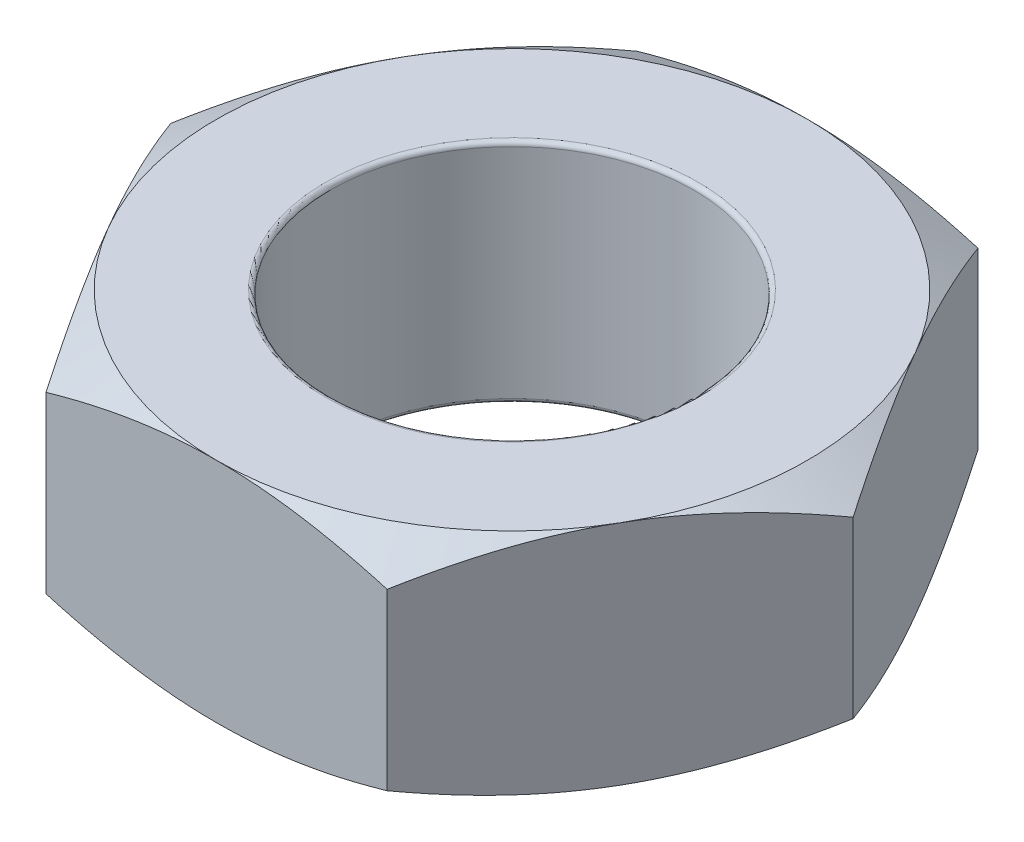
from build123d import *

# Parameters (mm, degrees)
SKETCH1_R           = 1
BOSS_EXTRUDE3_DEPTH = 1.25
SKETCH3_OUTSIDE_W   = 10.24
SKETCH3_OUTSIDE_H   = 9.738
SKETCH3_OUTSIDE_R   = 1.625
CUT_EXTRUDE1_DEPTH  = 1
CUT_EXTRUDE1_DRAFT  = -60
SKETCH4_OUTSIDE_W   = 10.24
SKETCH4_OUTSIDE_H   = 9.738
SKETCH4_OUTSIDE_R   = 1.625
CUT_EXTRUDE2_DEPTH  = 1
CUT_EXTRUDE2_DRAFT  = -60
FILLET1_R           = 0.025


with BuildPart() as part:
    # Sketch1 → Boss-Extrude3 (new body)
    with BuildSketch(Plane(origin=(0, 0, 0), x_dir=(1, 0, 0), z_dir=(0, 1, 0))):
        Polygon((-1.876388375, 0), (-0.938194187, -1.625), (0.938194187, -1.625), (1.876388375, 0), (0.938194187, 1.625), (-0.938194187, 1.625), align=None)
        with Locations(Location((0, 0, 0), (0, 0, 270))):
            Circle(SKETCH1_R, mode=Mode.SUBTRACT)
    extrude(amount=BOSS_EXTRUDE3_DEPTH)


with BuildPart() as cut_extrude1_tool:
    # Sketch3 outside → Cut-Extrude1 (with draft: the straight prism first)
    with BuildSketch(Plane(origin=(0, 1.25, 0), x_dir=(1, 0, 0), z_dir=(0, 1, 0))):
        Rectangle(SKETCH3_OUTSIDE_W, SKETCH3_OUTSIDE_H)
        Circle(SKETCH3_OUTSIDE_R, mode=Mode.SUBTRACT)
    extrude(amount=-CUT_EXTRUDE1_DEPTH)
    # Cut-Extrude1: the draft: its side faces are tilted about the plane it starts from
    cut_extrude1_sides = [cut_extrude1_tool.faces().sort_by_distance(p)[0] for p in [
        (0, 0.75, 4.869),
        (5.12, 0.75, 0),
        (0, 0.75, -4.869),
        (-5.12, 0.75, 0),
        (-1.625, 0.75, 0),
    ]]
    draft(cut_extrude1_sides, Plane(origin=(0, 1.25, 0), x_dir=(1, 0, 0), z_dir=(0, 1, 0)), CUT_EXTRUDE1_DRAFT)


with BuildPart() as part_1:
    add(part.part)

    # Cut-Extrude1: cut by cut_extrude1_tool
    add(cut_extrude1_tool.part, mode=Mode.SUBTRACT)


with BuildPart() as cut_extrude2_tool:
    # Sketch4 outside → Cut-Extrude2 (with draft: the straight prism first)
    with BuildSketch(Plane.XZ):
        Rectangle(SKETCH4_OUTSIDE_W, SKETCH4_OUTSIDE_H)
        Circle(SKETCH4_OUTSIDE_R, mode=Mode.SUBTRACT)
    extrude(amount=-CUT_EXTRUDE2_DEPTH)
    # Cut-Extrude2: the draft: its side faces are tilted about the plane it starts from
    cut_extrude2_sides = [cut_extrude2_tool.faces().sort_by_distance(p)[0] for p in [
        (0, 0.5, -4.869),
        (5.12, 0.5, 0),
        (0, 0.5, 4.869),
        (-5.12, 0.5, 0),
        (-1.625, 0.5, 0),
    ]]
    draft(cut_extrude2_sides, Plane.XZ, CUT_EXTRUDE2_DRAFT)


with BuildPart() as part_2:
    add(part_1.part)

    # Cut-Extrude2: cut by cut_extrude2_tool
    add(cut_extrude2_tool.part, mode=Mode.SUBTRACT)

    # Fillet1
    fillet1_edges = [part_2.edges().sort_by_distance(p)[0] for p in [
        (0, 0, -1),
        (0, 1.25, -1),
    ]]
    fillet(fillet1_edges, radius=FILLET1_R)


solid = part_2.part
